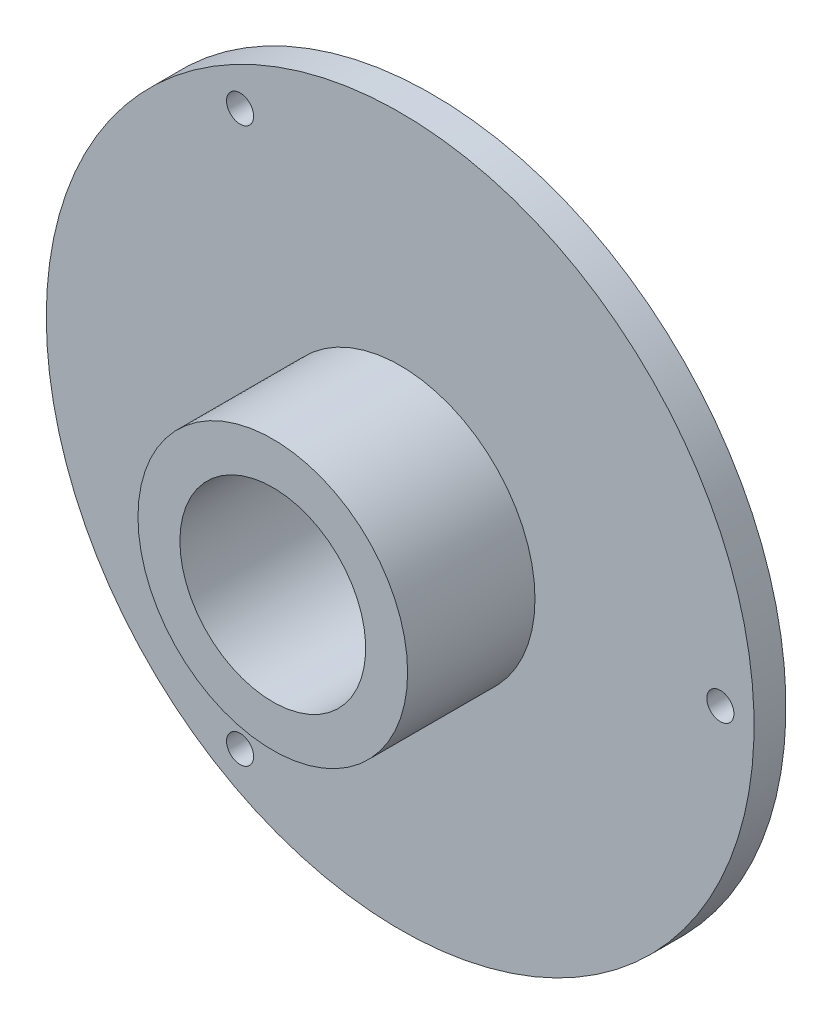
from build123d import *
from build123d.topology import SkipClean

# Parameters (mm, degrees)
SKETCH18_R             = 47.625
CUT_EXTRUDE2_DEPTH     = 5
F_10_CLEARANCE_HOLE1_D = 5.1054
CIRPATTERN1_COUNT      = 3


with BuildPart() as part:
    # Sketch24 → Revolve1 (revolve)
    with BuildSketch(Plane(origin=(0, 0, 0), x_dir=(1, 0, 0), z_dir=(0, 1, 0))):
        Polygon((-37, 81.654237034), (-37, 76.654237034), (-47.625, 76.654237034), (-47.625, 71.654237034), (-66.675, 71.654237034), (-66.675, 65.654237034), (-25.4, 65.654237034), (-25.4, 41.654237034), (-17.5, 41.654237034), (-17.5, 70.627957592), (-34, 80.154237034), (-34, 81.654237034), align=None)
    revolve(axis=Axis((0, 0, -86.654237034), (0, 0, 1)))

    # Sketch18 → Cut-Extrude2 (cut)
    with SkipClean():  # the faces are left unmerged after this step: merging them gives an invalid solid
        with BuildSketch(Plane.XY.offset(-76.654237034)):
            Circle(SKETCH18_R)
            with BuildLine():
                ThreePointArc((36.803517411, -3.8080318), (37.978132396, -5.474504313), (39.552581276, -6.769865934))
                ThreePointArc((39.552581276, -6.769865934), (42.805320101, -10.94498561), (42.554027377, -16.231646763))
                add(Edge.make_bspline(
                    [(28.227591738, 23.920766389), (28.169074611, 23.995894132), (27.726201544, 24.559979405), (26.867938753, 25.590107465), (25.60001603, 26.964989265), (24.261773335, 28.277085961), (22.856314773, 29.522798851), (21.386929147, 30.698682629), (19.85708232, 31.801454876), (18.270409111, 32.828005175), (16.630704717, 33.775403815), (14.941915703, 34.640910073), (13.208130556, 35.421980041), (11.43356985, 36.116273987), (9.622576022, 36.721663214), (7.779602801, 37.236236415), (5.909204301, 37.658305492), (4.016023818, 37.986410831), (2.104782347, 38.219326014), (0.180266852, 38.356061949), (-1.75268168, 38.395870413), (-3.689180377, 38.338246992), (-5.624316777, 38.182933409), (-7.553161251, 37.929919231), (-9.470779522, 37.579442948), (-11.37224525, 37.131992419), (-13.252652651, 36.588304682), (-15.107129112, 35.949365124), (-16.930847778, 35.216406011), (-18.719040078, 34.390904381), (-20.467008144, 33.474579298), (-22.170137115, 32.469388481), (-23.823907266, 31.377524301), (-25.42390596, 30.201409162), (-26.965839357, 28.943690275), (-28.445543888, 27.607233836), (-29.858997424, 26.195118613), (-31.202330147, 24.710628968), (-32.471835063, 23.157247319), (-33.663978152, 21.538646066), (-34.775408104, 19.858679), (-35.802965645, 18.121372202), (-36.743692396, 16.330914471), (-37.594839261, 14.491647299), (-38.353874308, 12.608054401), (-39.018490139, 10.68475085), (-39.586610697, 8.726471825), (-40.056397525, 6.738061006), (-40.426255434, 4.724458642), (-40.694837576, 2.690689328), (-40.861049894, 0.641849508), (-40.924054953, -1.416905249), (-40.883275123, -3.480373184), (-40.738395114, -5.543319447), (-40.489363842, -7.600489337), (-40.13639564, -9.646621653), (-39.679970776, -11.676462103), (-39.120835312, -13.684776759), (-38.460000265, -15.666365517), (-37.698740094, -17.61607551), (-36.838590511, -19.528814477), (-35.881345602, -21.399564006), (-34.829054288, -23.223392663), (-33.684016107, -24.995468936), (-32.44877635, -26.711073982), (-31.126120537, -28.365614138), (-29.719068263, -29.954633155), (-28.230866416, -31.473824138), (-26.664981791, -32.919041144), (-25.025093105, -34.286310417), (-23.315082441, -35.571841228), (-21.53902614, -36.772036288), (-19.701185153, -37.883501708), (-17.805994889, -38.903056478), (-15.85805457, -39.827741435), (-13.862116128, -40.654827709), (-11.823072667, -41.381824596), (-9.745946518, -42.006486871), (-7.635876912, -42.526821485), (-5.498107312, -42.941093656), (-3.337972426, -43.247832311), (-1.160884928, -43.445834888), (1.027678058, -43.534171454), (3.222188708, -43.512188152), (5.417082419, -43.379509955), (7.606771886, -43.136042707), (9.785661288, -42.781974466), (11.948160555, -42.317776118), (14.08869967, -41.74420128), (16.201742982, -41.062285471), (18.281803484, -40.273344558), (20.323457017, -39.378972487), (22.321356376, -38.381038284), (24.27024527, -37.281682345), (26.164972102, -36.083312015), (28.000503535, -34.788596469), (29.77193781, -33.400460899), (31.474517775, -31.92208003), (33.103643596, -30.356870964), (34.654885111, -28.708485383), (36.123993806, -26.980801118), (37.506914359, -25.17791311), (38.799795742, -23.304123775), (39.999001844, -21.363932809), (41.101121576, -19.362026441), (41.938186302, -17.641904891), (42.402189205, -16.588613759), (42.554027377, -16.231646763)],
                    knots=[0.099688645, 0.099688645, 0.099688645, 0.099688645, 0.100798534, 0.108047194, 0.115310927, 0.122589766, 0.12988374, 0.13719288, 0.144517215, 0.151856774, 0.159211583, 0.16658167, 0.173967063, 0.181367786, 0.188783866, 0.196215328, 0.203662198, 0.211124498, 0.218602253, 0.226095488, 0.233604225, 0.241128486, 0.248668296, 0.256223676, 0.263794648, 0.271381234, 0.278983456, 0.286601335, 0.294234891, 0.301884146, 0.309549121, 0.317229835, 0.324926308, 0.332638561, 0.340366614, 0.348110485, 0.355870195, 0.363645762, 0.371437205, 0.379244543, 0.387067795, 0.39490698, 0.402762115, 0.410633219, 0.41852031, 0.426423405, 0.434342523, 0.442277682, 0.450228898, 0.458196189, 0.466179572, 0.474179065, 0.482194684, 0.490226447, 0.498274369, 0.506338468, 0.514418761, 0.522515263, 0.530627991, 0.538756962, 0.546902191, 0.555063694, 0.563241488, 0.571435588, 0.57964601, 0.58787277, 0.596115883, 0.604375364, 0.61265123, 0.620943495, 0.629252175, 0.637577285, 0.64591884, 0.654276855, 0.662651345, 0.671042324, 0.679449808, 0.687873812, 0.696314349, 0.704771435, 0.713245083, 0.721735309, 0.730242127, 0.738765551, 0.747305595, 0.755862273, 0.7644356, 0.77302559, 0.781632256, 0.790255613, 0.798895674, 0.807552454, 0.816225965, 0.824916222, 0.833623239, 0.842347028, 0.851087604, 0.859844979, 0.868619169, 0.877410184, 0.88621804, 0.895042749, 0.903884325, 0.912742781, 0.921618129, 0.930510383, 0.935031581, 0.935031581, 0.935031581, 0.935031581], degree=3))
                ThreePointArc((28.227591738, 23.920766389), (34.737738084, 12.739291693), (37, 0))
                ThreePointArc((37, 0), (36.950846703, -1.906548688), (36.803517411, -3.8080318))
            make_face(mode=Mode.SUBTRACT)
        extrude(amount=CUT_EXTRUDE2_DEPTH, mode=Mode.SUBTRACT)

    # #10 Clearance Hole1 (through all)
    with Locations(Plane(origin=(60.325, 0, -71.654237034), x_dir=(-1, 0, 0), z_dir=(0, 0, -1))):
        with Locations((0, 0)):
            f_10_clearance_hole1 = Hole(F_10_CLEARANCE_HOLE1_D / 2)

    # CirPattern1: #10 Clearance Hole1 ×3 about axis
    with SkipClean():  # the faces are left unmerged after this step: merging them gives an invalid solid
        cirpattern1_axis = Axis((0, 0, 0), (0, 0, 1))
        for i in range(1, CIRPATTERN1_COUNT):
            add(f_10_clearance_hole1.rotate(cirpattern1_axis, i * 360 / CIRPATTERN1_COUNT), mode=Mode.SUBTRACT)


solid = part.part
